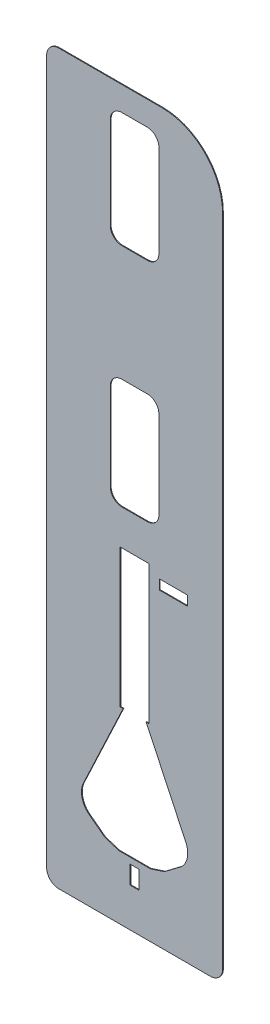
from build123d import *

# Parameters (mm, degrees)
BOSS_EXTRUDE5_DEPTH = 0.125
SKETCH1_W           = 1.5
SKETCH1_H           = 3
SKETCH1_W_2         = 4.66
SKETCH1_H_2         = 1.6
CUT_EXTRUDE2_DEPTH  = 62.727349085


with BuildPart() as part:
    # Sketch8 → Boss-Extrude5 (new body)
    with BuildSketch(Plane.XY):
        with BuildLine():
            Line((-12.5, 60), (4.5, 60))
            ThreePointArc((4.5, 60), (11.571067812, 57.071067812), (14.5, 50))
            Line((14.5, 50), (14.5, -58))
            ThreePointArc((14.5, -58), (13.914213562, -59.414213562), (12.5, -60))
            Line((12.5, -60), (-12.5, -60))
            ThreePointArc((-12.5, -60), (-13.914213562, -59.414213562), (-14.5, -58))
            Line((-14.5, -58), (-14.5, 58))
            ThreePointArc((-14.5, 58), (-13.914213562, 59.414213562), (-12.5, 60))
        make_face()
    extrude(amount=BOSS_EXTRUDE5_DEPTH)

    # Sketch1 → Cut-Extrude2 (cut, through all)
    with BuildSketch(Plane.XY.offset(0.125)):
        with BuildLine():
            Line((2.6, -49.6), (4.925, -48.85))
            Line((4.925, -48.85), (7.4, -46.97314145))
            add(Edge.make_bspline(
                [(7.4, -46.97314145), (8.211440188, -46.416320927), (8.75059415, -45.427724457), (8.749703343, -43.736930638), (8.614001568, -43.20601542), (8.375, -42.75)],
                knots=[3, 3, 3, 3, 3.998304655, 3.998304655, 4.496755106, 4.496755106, 4.496755106, 4.496755106], degree=3))
            Line((8.375, -42.75), (1.9, -29))
            Line((1.9, -29), (2.4, -29))
            Line((2.4, -29), (2.4, -6.15))
            Line((2.4, -6.15), (-2.4, -6.15))
            Line((-2.4, -6.15), (-2.4, -29))
            Line((-2.4, -29), (-1.9, -29))
            Line((-1.9, -29), (-8.375, -42.75))
            add(Edge.make_bspline(
                [(-8.375, -42.75), (-8.614001568, -43.20601542), (-8.749703343, -43.736930638), (-8.75059415, -45.427724457), (-8.211440188, -46.416320927), (-7.4, -46.97314145)],
                knots=[2, 2, 2, 2, 3, 3, 5.002816232, 5.002816232, 5.002816232, 5.002816232], degree=3))
            Line((-7.4, -46.97314145), (-4.925, -48.85))
            Line((-4.925, -48.85), (-2.6, -49.6))
            Line((-2.6, -49.6), (2.6, -49.6))
        make_face()
        with Locations((0, -52.1)):
            Rectangle(SKETCH1_W, SKETCH1_H)
        with Locations((6.41, -8.27)):
            Rectangle(SKETCH1_W_2, SKETCH1_H_2)
        with BuildLine():
            ThreePointArc((-2.1, 17.931829774), (-3.443502884, 17.375332658), (-4, 16.031829774))
            Line((-4, 16.031829774), (-4, 1.6))
            ThreePointArc((-4, 1.6), (-3.443502884, 0.256497116), (-2.1, -0.3))
            Line((-2.1, -0.3), (2.1, -0.3))
            ThreePointArc((2.1, -0.3), (3.443502884, 0.256497116), (4, 1.6))
            Line((4, 1.6), (4, 16.031829774))
            ThreePointArc((4, 16.031829774), (3.443502884, 17.375332658), (2.1, 17.931829774))
            Line((2.1, 17.931829774), (-2.1, 17.931829774))
        make_face()
        with BuildLine():
            ThreePointArc((-2.1, 56), (-3.443502884, 55.443502884), (-4, 54.1))
            Line((-4, 54.1), (-4, 38.9))
            ThreePointArc((-4, 38.9), (-3.443502884, 37.556497116), (-2.1, 37))
            Line((-2.1, 37), (2.1, 37))
            ThreePointArc((2.1, 37), (3.443502884, 37.556497116), (4, 38.9))
            Line((4, 38.9), (4, 54.1))
            ThreePointArc((4, 54.1), (3.443502884, 55.443502884), (2.1, 56))
            Line((2.1, 56), (-2.1, 56))
        make_face()
    extrude(amount=-CUT_EXTRUDE2_DEPTH, mode=Mode.SUBTRACT)


solid = part.part
